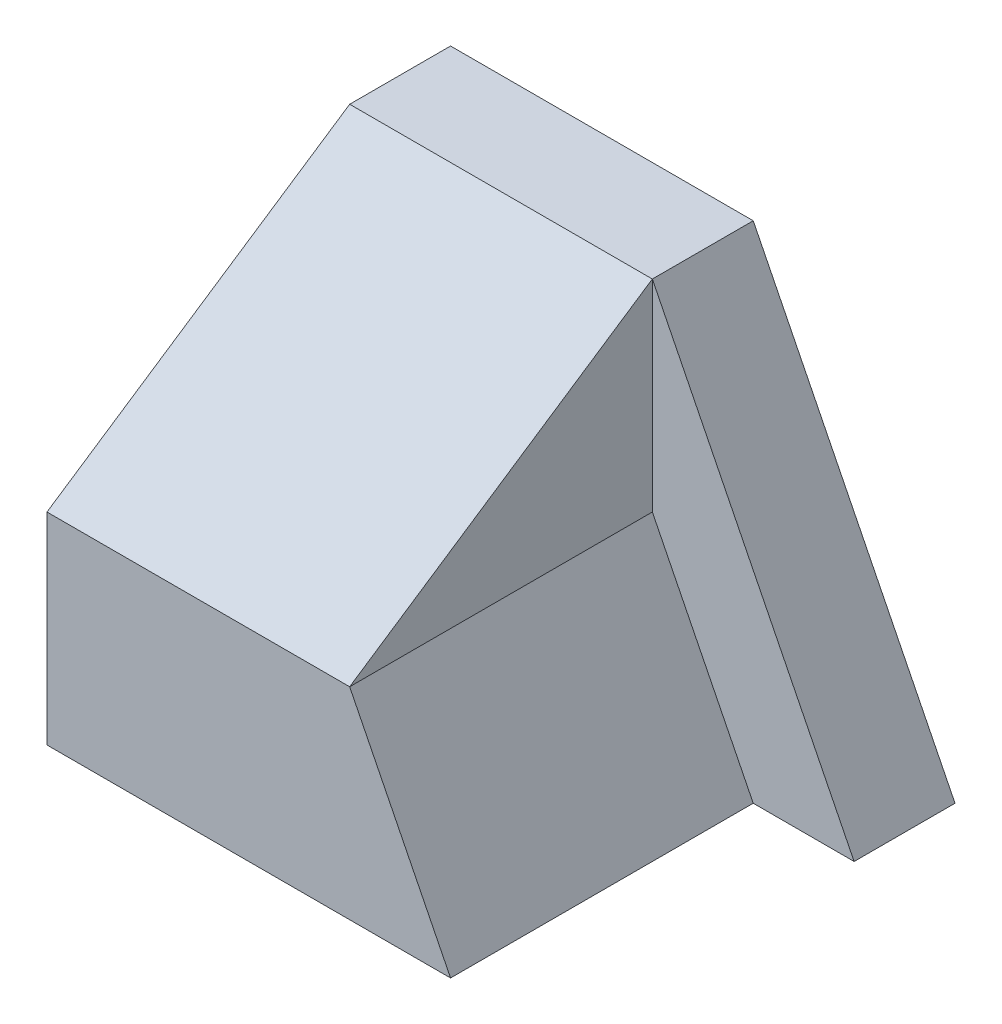
from build123d import *

# Parameters (mm, degrees)
SKETCH1_W           = 3
SKETCH1_H           = 1
BOSS_EXTRUDE1_DEPTH = 4
SKETCH2_W           = 2
SKETCH2_H           = 1
BOSS_EXTRUDE3_DEPTH = 4
CUT_EXTRUDE3_DEPTH  = 4
BOSS_EXTRUDE4_DEPTH = 3
SKETCH5_W           = 3
SKETCH5_H           = 2
BOSS_EXTRUDE6_DEPTH = 3
CUT_EXTRUDE4_DEPTH  = 3


with BuildPart() as part:
    # Sketch1 → Boss-Extrude1 (new body)
    with BuildSketch(Plane(origin=(0, 0, 0), x_dir=(1, 0, 0), z_dir=(0, 1, 0))):
        with Locations((1.5, 0.5)):
            Rectangle(SKETCH1_W, SKETCH1_H)
    extrude(amount=BOSS_EXTRUDE1_DEPTH)



with BuildPart() as body_2:
    # Sketch2 → Boss-Extrude3 (new body)
    with BuildSketch(Plane.XZ):
        with Locations((4, -0.5)):
            Rectangle(SKETCH2_W, SKETCH2_H)
    extrude(amount=-BOSS_EXTRUDE3_DEPTH)

    # Sketch3 → Cut-Extrude3 (cut)
    with BuildSketch(Plane.XY):
        Polygon((3, 4), (5, 0), (5, 4), align=None)
    extrude(amount=-CUT_EXTRUDE3_DEPTH, mode=Mode.SUBTRACT)


with BuildPart() as part_1:
    add(part.part)

    add(body_2.part)  # Boss-Extrude4 merges body 2
    # Sketch4 → Boss-Extrude4 (add)
    with BuildSketch(Plane.XY):
        Polygon((0, 0), (4, 0), (3, 2), (0, 2), align=None)
    extrude(amount=BOSS_EXTRUDE4_DEPTH)


with BuildPart() as body_2_2:
    # Sketch5 → Boss-Extrude6 (new body)
    with BuildSketch(Plane.XY):
        with Locations((1.5, 3)):
            Rectangle(SKETCH5_W, SKETCH5_H)
    extrude(amount=BOSS_EXTRUDE6_DEPTH)

    # Sketch6 → Cut-Extrude4 (cut)
    with BuildSketch(Plane(origin=(3, 0, 0), x_dir=(0, 0, -1), z_dir=(1, 0, 0))):
        Polygon((-3, 2), (0, 4), (-3, 4), align=None)
    extrude(amount=-CUT_EXTRUDE4_DEPTH, mode=Mode.SUBTRACT)


solid = Compound([part_1.part, body_2_2.part])
